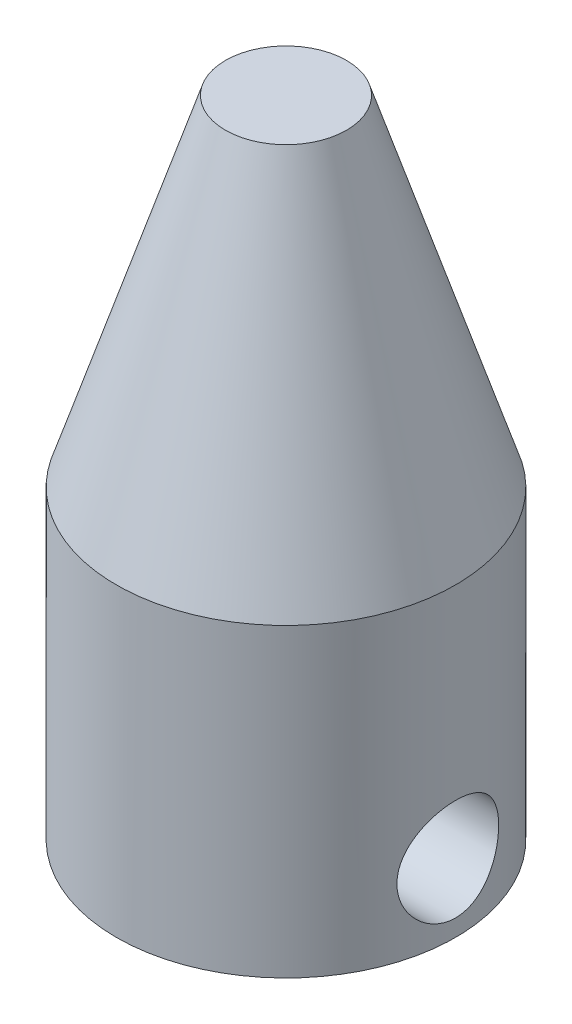
from build123d import *

# Parameters (mm, degrees)
SKETCH1_R             = 5
BODY_DEPTH            = 9
PIN_INSERT_DEPTH      = 12.445523142
PIN_INSERT_DEPTH_BACK = 12.445523142
SKETCH2_R             = 1.5
HEAD_SA_R             = 1.784


with BuildPart() as part:
    # Sketch1 → body (new body)
    with BuildSketch(Plane(origin=(0, 0, 0), x_dir=(1, 0, 0), z_dir=(0, 1, 0))):
        with Locations(Location((0, 0, 0), (0, 0, 270))):
            Circle(SKETCH1_R)
    extrude(amount=BODY_DEPTH)

    # Sketch2 → pin insert (cut, two sides: drawn at the far end of the back side and taken through both)
    with BuildSketch(Plane(origin=(0, 0, 0), x_dir=(0, 0, -1), z_dir=(1, 0, 0)).offset(-PIN_INSERT_DEPTH_BACK)):
        with Locations((0, 2)):
            Circle(SKETCH2_R)
    extrude(amount=PIN_INSERT_DEPTH + PIN_INSERT_DEPTH_BACK, mode=Mode.SUBTRACT)

    # head SA → section 0 of cone
    with BuildSketch(Plane(origin=(0, 19, 0), x_dir=(1, 0, 0), z_dir=(0, 1, 0)), mode=Mode.PRIVATE) as cone_s0:
        Circle(HEAD_SA_R)
    # loft up to a face of the part (cone)
    loft([cone_s0.sketch, part.faces().sort_by_distance((0, 9, 0))[0]])


solid = part.part
